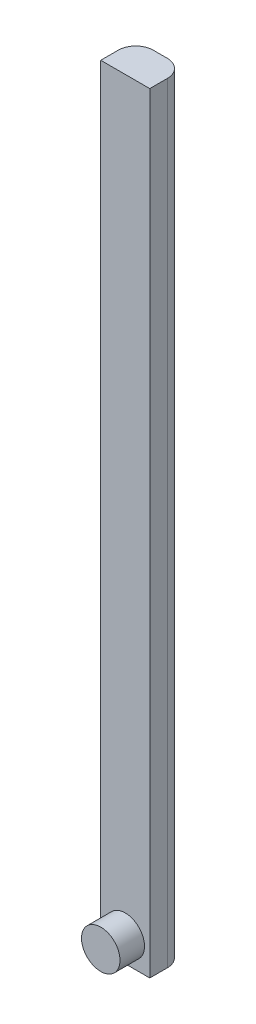
from build123d import *

# Parameters (mm, degrees)
SKETCH1_W           = 7
SKETCH1_H           = 110
BOSS_EXTRUDE1_DEPTH = 5
FILLET4_R           = 2.5
SKETCH2_R           = 2.75
BOSS_EXTRUDE2_DEPTH = 3.5


with BuildPart() as part:
    # Sketch1 → Boss-Extrude1 (new body)
    with BuildSketch(Plane.XY):
        with Locations((3.5, 55)):
            Rectangle(SKETCH1_W, SKETCH1_H)
    extrude(amount=BOSS_EXTRUDE1_DEPTH)

    # Fillet4
    fillet4_edges = [part.edges().sort_by_distance(p)[0] for p in [
        (7, 55, 0),
        (0, 55, 0),
    ]]
    fillet(fillet4_edges, radius=FILLET4_R)

    # Sketch2 → Boss-Extrude2 (add)
    with BuildSketch(Plane.XY.offset(5)):
        with Locations((3.5, 3.548899595)):
            Circle(SKETCH2_R)
    extrude(amount=BOSS_EXTRUDE2_DEPTH)


solid = part.part
